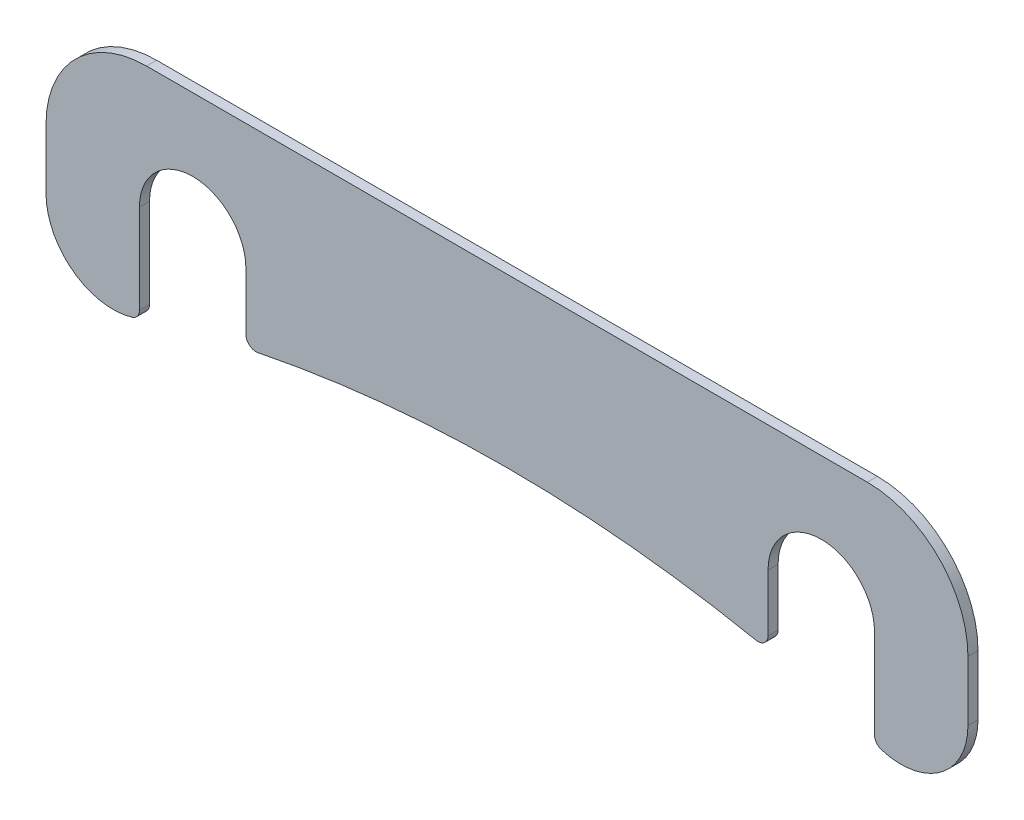
from build123d import *

# Parameters (mm, degrees)
BOSS_EXTRUDE1_DEPTH = 0.762
FILLET1_R           = 0.762


with BuildPart() as part:
    # Sketch1 → Boss-Extrude1 (new body)
    with BuildSketch(Plane.XY):
        with BuildLine():
            Line((-27.305, 9.525), (27.305, 9.525))
            ThreePointArc((27.305, 9.525), (32.693153673, 7.293153673), (34.925, 1.905))
            Line((34.925, 1.905), (34.925, -2.636770687))
            ThreePointArc((34.925, -2.636770687), (32.855798288, -6.728407727), (28.333860759, -7.486807614))
            ThreePointArc((28.333860759, -7.486807614), (28.089406783, -7.411002579), (27.84475, -7.335854667))
            Line((27.84475, -7.335854667), (27.84475, 0))
            ThreePointArc((27.84475, 0), (23.8125, 4.03225), (19.78025, 0))
            Line((19.78025, 0), (19.78025, -5.251483323))
            ThreePointArc((19.78025, -5.251483323), (0, -3.175), (-19.78025, -5.251483323))
            Line((-19.78025, -5.251483323), (-19.78025, 0))
            ThreePointArc((-19.78025, 0), (-23.8125, 4.03225), (-27.84475, 0))
            Line((-27.84475, 0), (-27.84475, -7.335854667))
            ThreePointArc((-27.84475, -7.335854667), (-28.089406783, -7.411002579), (-28.333860759, -7.486807614))
            ThreePointArc((-28.333860759, -7.486807614), (-32.855798288, -6.728407727), (-34.925, -2.636770687))
            Line((-34.925, -2.636770687), (-34.925, 1.905))
            ThreePointArc((-34.925, 1.905), (-32.693153673, 7.293153673), (-27.305, 9.525))
        make_face()
    extrude(amount=BOSS_EXTRUDE1_DEPTH)

    # Fillet1
    fillet1_edges = [part.edges().sort_by_distance(p)[0] for p in [
        (27.84475, -7.335854667, 0.381),
        (19.78025, -5.251483323, 0.381),
        (-19.78025, -5.251483323, 0.381),
        (-27.84475, -7.335854667, 0.381),
    ]]
    fillet(fillet1_edges, radius=FILLET1_R)


solid = part.part
